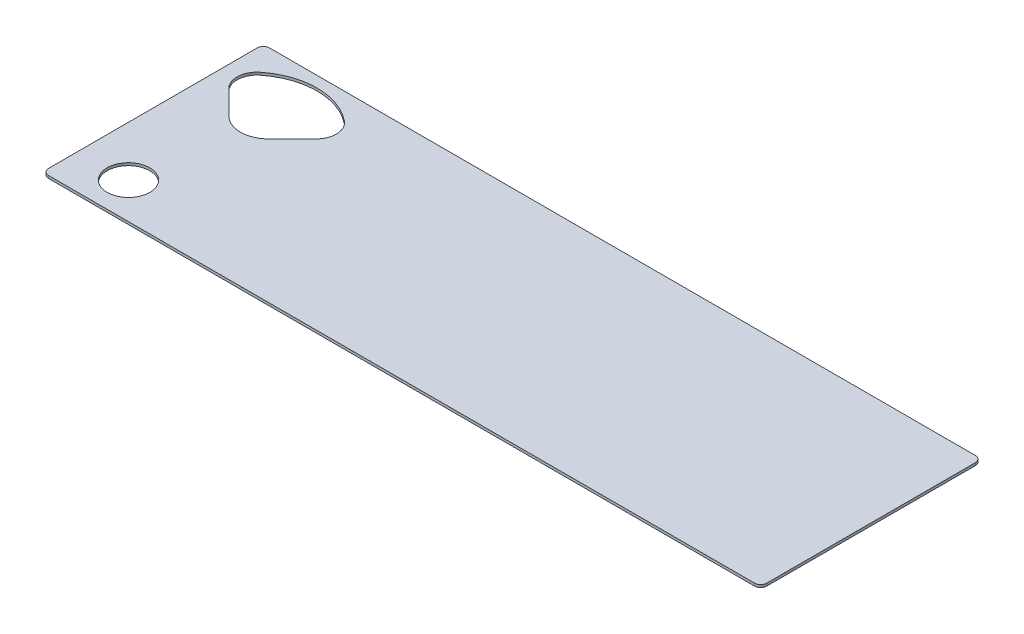
from build123d import *

# Parameters (mm, degrees)
BOSS_EXTRUDE1_DEPTH = 6.35
CUT_EXTRUDE1_DEPTH  = 918.402376548
SKETCH3_R           = 52.07
CUT_EXTRUDE2_DEPTH  = 918.402376548


with BuildPart() as part:
    # Sketch1 → Boss-Extrude1 (new body)
    with BuildSketch(Plane(origin=(0, 0, 0), x_dir=(1, 0, 0), z_dir=(0, 1, 0))):
        with BuildLine():
            Line((-861.694916994, -269.761320345), (861.694916994, -269.761320345))
            add(Edge.make_bspline(
                [(861.694916994, -269.761320345), (876.821320345, -269.761320345), (876.821320345, -254.634916994)],
                knots=[5.505213485, 5.505213485, 5.505213485, 7.061157129, 7.061157129, 7.061157129], degree=2, weights=[1, 0.712338451, 1]))
            Line((876.821320345, -254.634916994), (876.821320345, 254.634916994))
            add(Edge.make_bspline(
                [(876.821320345, 254.634916994), (876.821320345, 269.761320345), (861.694916994, 269.761320345)],
                knots=[5.505213485, 5.505213485, 5.505213485, 7.061157129, 7.061157129, 7.061157129], degree=2, weights=[1, 0.712338451, 1]))
            Line((861.694916994, 269.761320345), (-861.694916994, 269.761320345))
            add(Edge.make_bspline(
                [(-861.694916994, 269.761320345), (-876.821320345, 269.761320345), (-876.821320345, 254.634916994)],
                knots=[5.505213485, 5.505213485, 5.505213485, 7.061157129, 7.061157129, 7.061157129], degree=2, weights=[1, 0.712338451, 1]))
            Line((-876.821320345, 254.634916994), (-876.821320345, -254.634916994))
            add(Edge.make_bspline(
                [(-876.821320345, -254.634916994), (-876.821320345, -269.761320345), (-861.694916994, -269.761320345)],
                knots=[5.505213485, 5.505213485, 5.505213485, 7.061157129, 7.061157129, 7.061157129], degree=2, weights=[1, 0.712338451, 1]))
        make_face()
    extrude(amount=BOSS_EXTRUDE1_DEPTH)

    # Sketch2 → Cut-Extrude1 (cut, through all)
    with BuildSketch(Plane(origin=(0, 6.35, 0), x_dir=(1, 0, 0), z_dir=(0, 1, 0))):
        with BuildLine():
            Line((-825.954313113, 134.591457199), (-767.566332113, 76.203476199))
            ThreePointArc((-767.566332113, 76.203476199), (-719.067867535, 56.114754417), (-670.569402958, 76.203476199))
            Line((-670.569402958, 76.203476199), (-612.181421958, 134.591457199))
            ThreePointArc((-612.181421958, 134.591457199), (-598.021653058, 171.575128433), (-616.092530237, 206.813380252))
            ThreePointArc((-616.092530237, 206.813380252), (-719.067867535, 243.07718636), (-822.043204833, 206.813380252))
            ThreePointArc((-822.043204833, 206.813380252), (-840.114082012, 171.575128433), (-825.954313113, 134.591457199))
        make_face()
    extrude(amount=-CUT_EXTRUDE1_DEPTH, mode=Mode.SUBTRACT)

    # Sketch3 → Cut-Extrude2 (cut, through all)
    with BuildSketch(Plane(origin=(0, 6.35, 0), x_dir=(1, 0, 0), z_dir=(0, 1, 0))):
        with Locations((-754.506388348, -181.844577047)):
            Circle(SKETCH3_R)
    extrude(amount=-CUT_EXTRUDE2_DEPTH, mode=Mode.SUBTRACT)


solid = part.part
